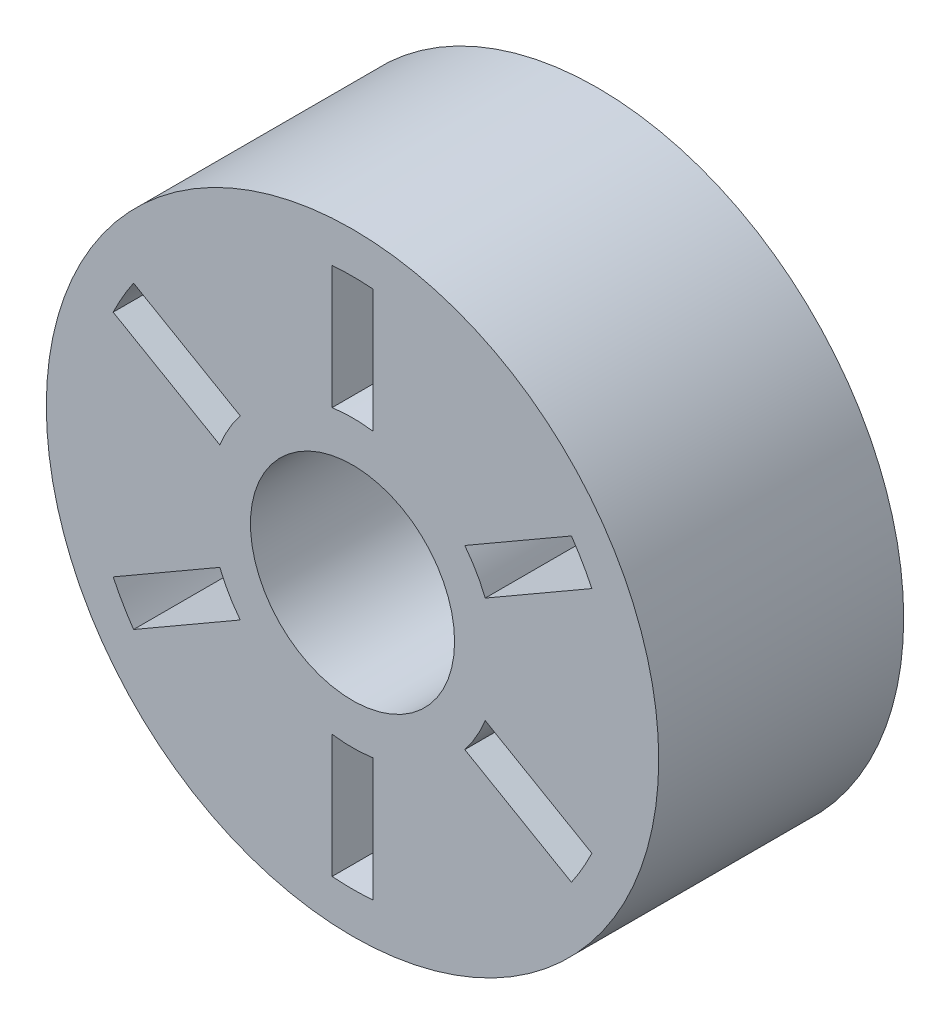
from build123d import *

# Parameters (mm, degrees)
SKETCH2_R           = 37.5
SKETCH2_R_2         = 12.5
BOSS_EXTRUDE1_DEPTH = 30
CUT_EXTRUDE1_DEPTH  = 61.930288035
CIRPATTERN1_COUNT   = 6


with BuildPart() as part:
    # Sketch2 → Boss-Extrude1 (new body)
    with BuildSketch(Plane.XY):
        Circle(SKETCH2_R)
        Circle(SKETCH2_R_2, mode=Mode.SUBTRACT)
    extrude(amount=BOSS_EXTRUDE1_DEPTH)

    # Sketch5 → Cut-Extrude1 (cut, through all)
    with BuildSketch(Plane.XY.offset(30)):
        with BuildLine():
            Line((2.5, 32.403703492), (2.5, 17.320508076))
            ThreePointArc((2.5, 17.320508076), (0, 17.5), (-2.5, 17.320508076))
            Line((-2.5, 17.320508076), (-2.5, 32.403703492))
            ThreePointArc((-2.5, 32.403703492), (0, 32.5), (2.5, 32.403703492))
        make_face()
    cut_extrude1 = extrude(amount=-CUT_EXTRUDE1_DEPTH, mode=Mode.SUBTRACT)

    # CirPattern1: Cut-Extrude1 ×6 about axis
    cirpattern1_axis = Axis((0, 0, 0), (0, 0, 1))
    for i in range(1, CIRPATTERN1_COUNT):
        add(cut_extrude1.rotate(cirpattern1_axis, i * 360 / CIRPATTERN1_COUNT), mode=Mode.SUBTRACT)


solid = part.part
